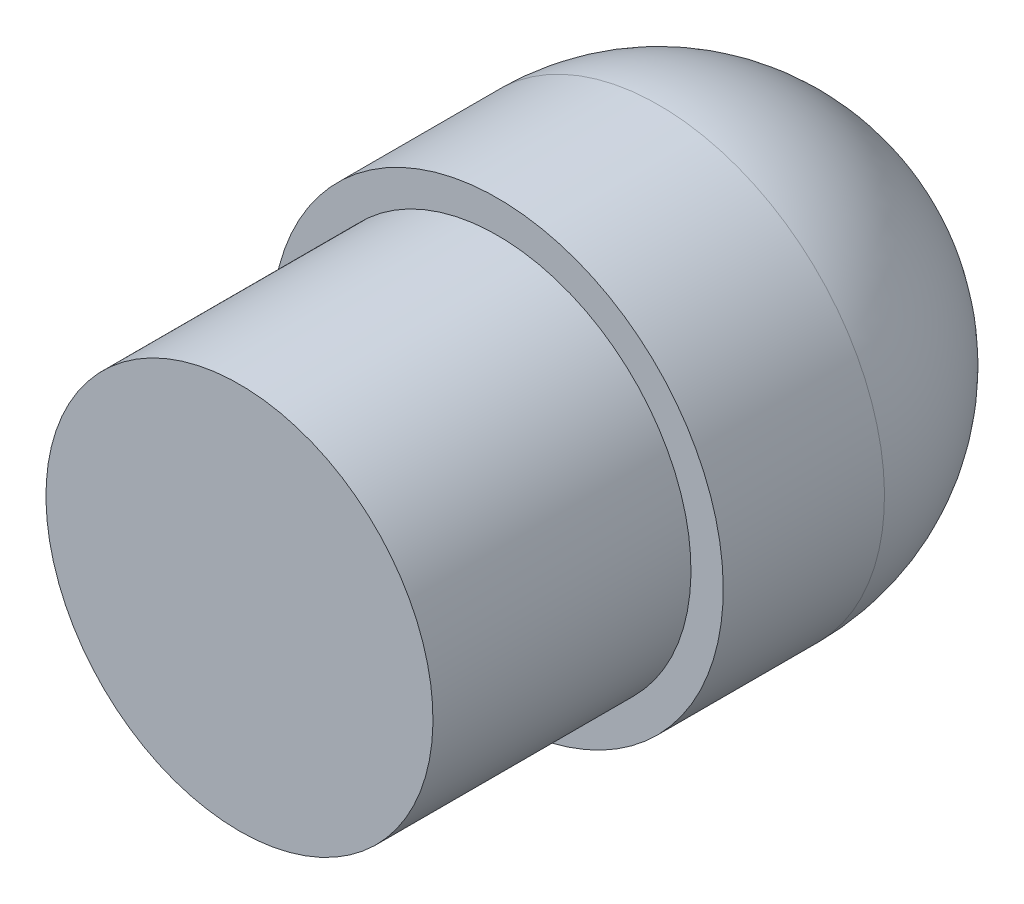
from build123d import *

# Parameters (mm, degrees)
CROQUIS1_W = 20
CROQUIS1_H = 15


with BuildPart() as part:
    # Croquis1 → Revolución1 (revolve)
    with BuildSketch(Plane(origin=(0, 0, 0), x_dir=(0, 0, -1), z_dir=(1, 0, 0)), mode=Mode.PRIVATE) as revoluci_n1_sk:
        with Locations((10, 7.5)):
            Rectangle(CROQUIS1_W, CROQUIS1_H)
        Polygon((20, 15), (20, 0), (32.5, 0), (32.5, 17.5), (20, 17.5), align=None)
        with BuildLine():
            Line((32.5, 17.5), (32.5, 0))
            Line((32.5, 0), (50, 0))
            ThreePointArc((50, 0), (44.874368671, 12.374368671), (32.5, 17.5))
        make_face()
    revolve(revoluci_n1_sk.sketch.rotate(Axis((0, 0, 0), (0, 0, -1)), 180), axis=Axis((0, 0, 0), (0, 0, -1)))


solid = part.part
